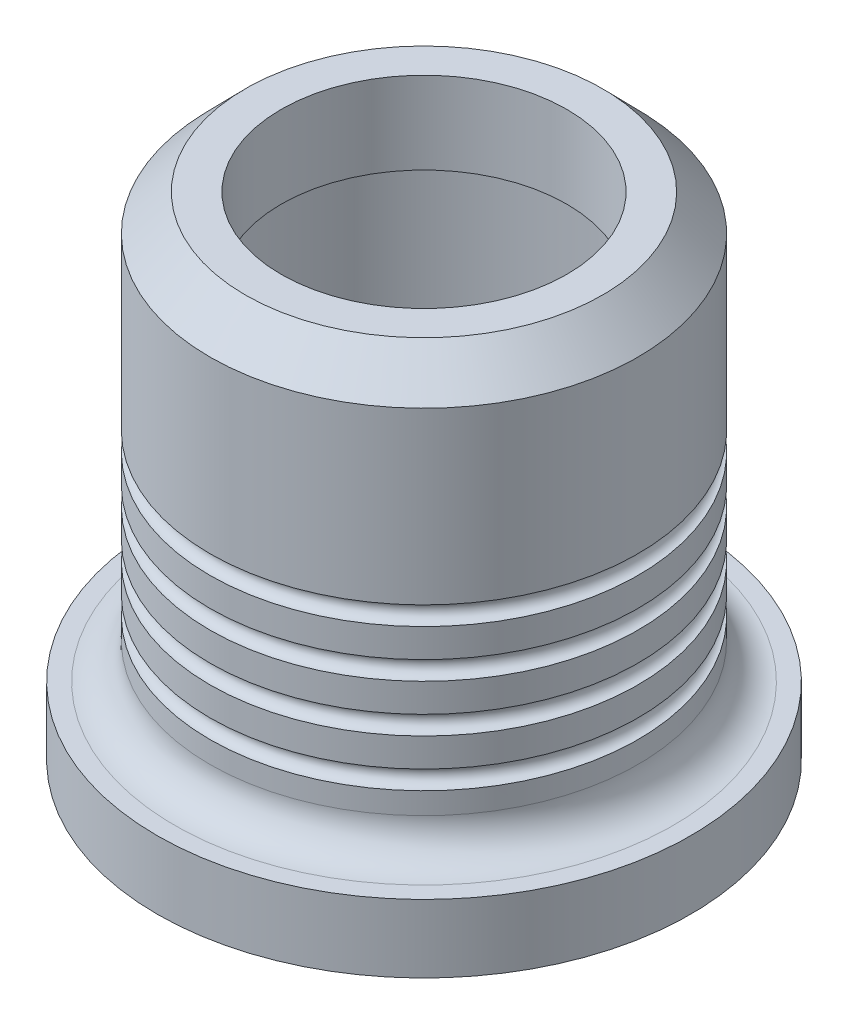
from build123d import *

# Parameters (mm, degrees)
FILLET4_R = 1.5


with BuildPart() as part:
    # Sketch1 → Revolve1 (revolve)
    with BuildSketch(Plane.XY, mode=Mode.PRIVATE) as revolve1_sk:
        with BuildLine():
            Line((6.09180829, 15.430866008), (7.615863529, 15.430866008))
            Line((7.615863529, 15.430866008), (9.122452328, 13.893098484))
            Line((9.122452328, 13.893098484), (9.122452328, 6.633027546))
            ThreePointArc((9.122452328, 6.633027546), (8.722452328, 6.233027546), (9.122452328, 5.833027546))
            Line((9.122452328, 5.833027546), (9.122452328, 4.613027546))
            ThreePointArc((9.122452328, 4.613027546), (8.722452328, 4.213027546), (9.122452328, 3.813027546))
            Line((9.122452328, 3.813027546), (9.122452328, 2.593027546))
            ThreePointArc((9.122452328, 2.593027546), (8.722452328, 2.193027546), (9.122452328, 1.793027546))
            Line((9.122452328, 1.793027546), (9.122452328, 0.573027546))
            ThreePointArc((9.122452328, 0.573027546), (8.722452328, 0.173027546), (9.122452328, -0.226972454))
            Line((9.122452328, -0.226972454), (9.122452328, -2.646972454))
            Line((9.122452328, -2.646972454), (11.375, -2.646972454))
            Line((11.375, -2.646972454), (11.375, -5.546972454))
            Line((11.375, -5.546972454), (8.075, -5.546972454))
            Line((8.075, -5.546972454), (8.075, -4.546972454))
            ThreePointArc((8.075, -4.546972454), (8.340690566, -3.79697245), (8.074999974, -3.046972454))
            Line((8.074999974, -3.046972454), (8.074999974, 11.930866008))
            Line((8.074999974, 11.930866008), (6.09180829, 11.930866008))
            Line((6.09180829, 11.930866008), (6.09180829, 15.430866008))
        make_face()
    revolve(revolve1_sk.sketch.rotate(Axis((0, 28.085075737, 0), (0, -1, 0)), 90), axis=Axis((0, 28.085075737, 0), (0, -1, 0)))

    # Fillet4
    fillet4_edges = [part.edges().sort_by_distance(p)[0] for p in [
        (0, -2.646972454, -9.122452328),
    ]]
    fillet(fillet4_edges, radius=FILLET4_R)


solid = part.part
